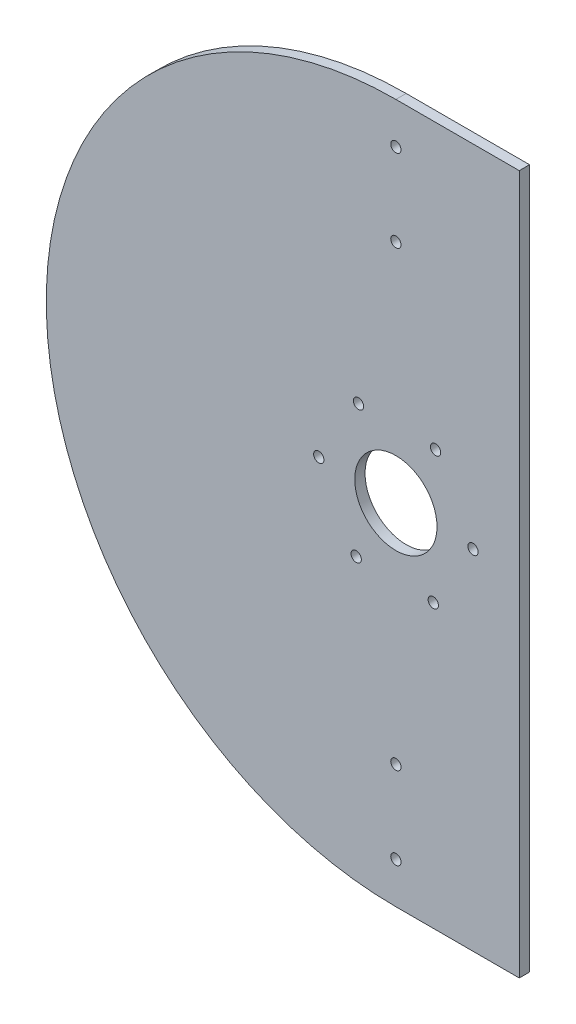
from build123d import *

# Parameters (mm, degrees)
BOSS_EXTRUDE1_DEPTH          = 3.175
F_1_8_0_125_DIAMETER_HOLE1_D = 3.175
SKETCH6_R                    = 12.7
CUT_EXTRUDE1_DEPTH           = 17.0815


with BuildPart() as part:
    # Sketch1 → Boss-Extrude1 (new body)
    with BuildSketch(Plane.XY):
        with BuildLine():
            Line((0, 107.95), (38.1, 107.95))
            Line((38.1, 107.95), (38.1, -107.95))
            Line((38.1, -107.95), (0, -107.95))
            ThreePointArc((0, -107.95), (-107.95, 0), (0, 107.95))
        make_face()
    extrude(amount=BOSS_EXTRUDE1_DEPTH)

    # 1/8 (0.125) Diameter Hole1 (through all)
    with Locations(Plane(origin=(0, 0, 0), x_dir=(-1, 0, 0), z_dir=(0, 0, -1))):
        with Locations((12.262546259, -20.412376527), (0, 95.25), (0, -95.25), (0, -69.85), (0, 69.85), (0, 0), (23.808909754, 0.413488312), (11.546363494, 20.825864839), (-12.262546259, 20.412376527), (-23.808909754, -0.413488312), (-11.546363494, -20.825864839)):
            Hole(F_1_8_0_125_DIAMETER_HOLE1_D / 2)

    # Sketch6 → Cut-Extrude1 (cut)
    with BuildSketch(Plane(origin=(0, 0, 0), x_dir=(-1, 0, 0), z_dir=(0, 0, -1))):
        Circle(SKETCH6_R)
    extrude(amount=-CUT_EXTRUDE1_DEPTH, mode=Mode.SUBTRACT)


solid = part.part
